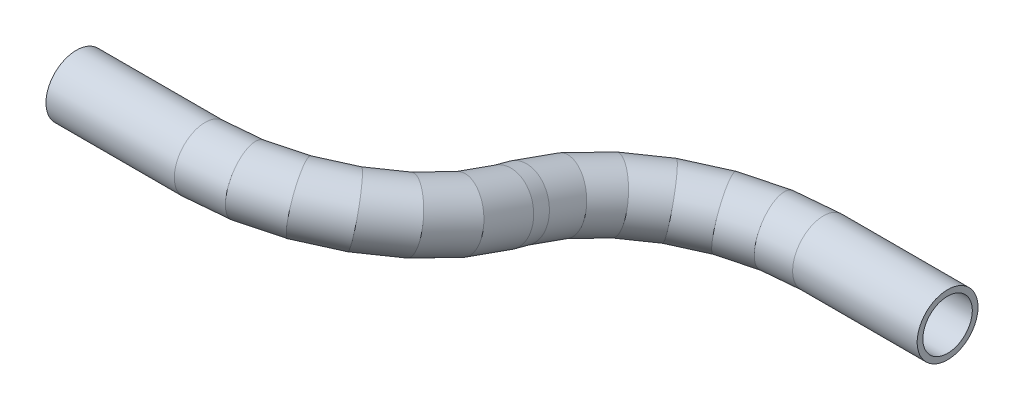
from build123d import *

# Parameters (mm, degrees)
PROFILE_R   = 4.7625
PROFILE_R_2 = 3.8735


with BuildPart() as part:
    # Tube: sweep along a curve in space
    with BuildLine() as tube_path:
        Line((-2318.387960479, -9.317485624, -34.773329746), (-2298.587960479, -9.317485624, -34.773329746))
        Line((-2298.587960479, -9.317485624, -34.773329746), (-2292.376303396, -9.529142706, -35.563244732))
        Line((-2292.376303396, -9.529142706, -35.563244732), (-2286.587960479, -10.149689873, -37.879158288))
        Line((-2286.587960479, -10.149689873, -37.879158288), (-2281.61739773, -11.136837861, -41.563244732))
        Line((-2281.61739773, -11.136837861, -41.563244732), (-2277.803350788, -12.423314165, -46.364439662))
        Line((-2277.803350788, -12.423314165, -46.364439662), (-2275.405740648, -13.921447552, -51.955549577))
        Line((-2275.405740648, -13.921447552, -51.955549577), (-2274.587960479, -15.529142706, -57.955549577))
        Line((-2274.587960479, -15.529142706, -57.955549577), (-2274.587960479, -16.189131271, -60.418660434))
        Line((-2274.587960479, -16.189131271, -60.418660434), (-2273.77018031, -17.796826426, -66.418660434))
        Line((-2273.77018031, -17.796826426, -66.418660434), (-2271.37257017, -19.294959812, -72.00977035))
        Line((-2271.37257017, -19.294959812, -72.00977035), (-2267.558523227, -20.581436117, -76.81096528))
        Line((-2267.558523227, -20.581436117, -76.81096528), (-2262.587960479, -21.568584104, -80.495051724))
        Line((-2262.587960479, -21.568584104, -80.495051724), (-2256.799617561, -22.189131271, -82.81096528))
        Line((-2256.799617561, -22.189131271, -82.81096528), (-2250.587960479, -22.400788354, -83.600880265))
        Line((-2250.587960479, -22.400788354, -83.600880265), (-2230.787960479, -22.400788354, -83.600880265))
    # Profile → Tube (sweep)
    with BuildSketch(Plane(origin=(-2318.387960479, 0, 0), x_dir=(0, 0, -1), z_dir=(1, 0, 0))):
        with Locations((34.773329746, -9.317485624)):
            Circle(PROFILE_R)
        with Locations((34.773329746, -9.317485624)):
            Circle(PROFILE_R_2, mode=Mode.SUBTRACT)
    sweep(path=tube_path.line, transition=Transition.RIGHT)


solid = part.part
